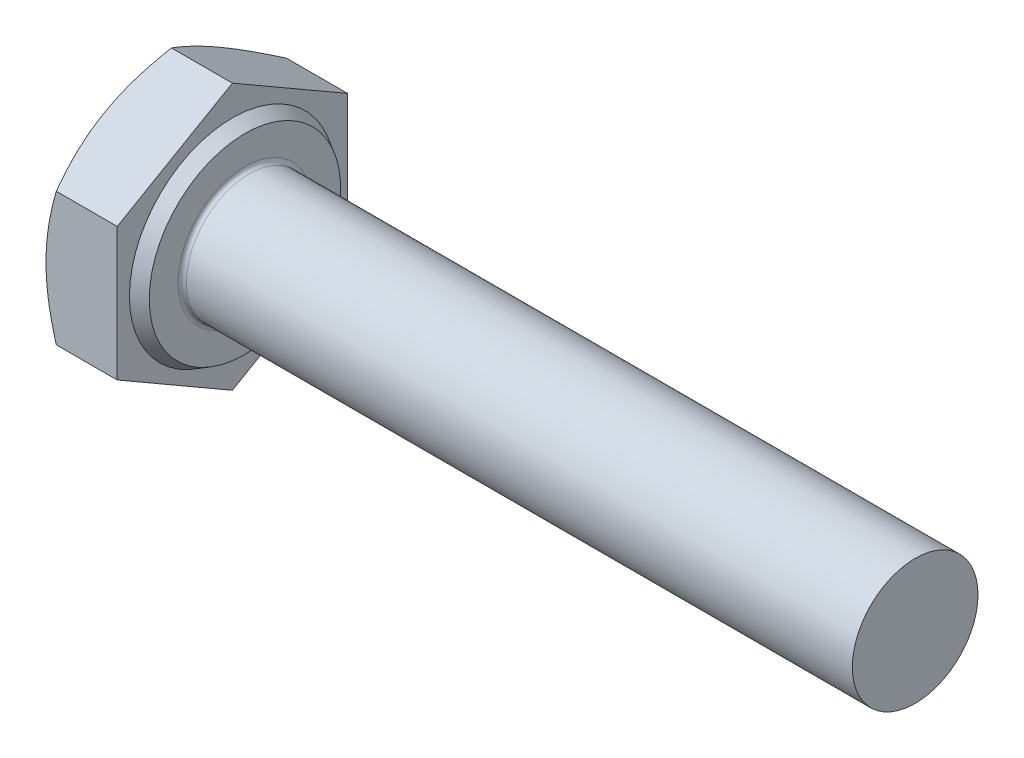
from build123d import *

# Parameters (mm, degrees)
EXTRUDE_400_DEPTH   = 2
FILLET_1302_R       = 0.1
SKETCH_7_R          = 3.348684761
CUT_EXTRUDE_1_DEPTH = 9


with BuildPart() as part:
    # 草图1 → Extrude 400 (new body)
    with BuildSketch(Plane(origin=(0, 0, 0), x_dir=(0, 0, -1), z_dir=(1, 0, 0))):
        Polygon((2.75, 1.58771324), (2.75, -1.58771324), (0, -3.175426481), (-2.75, -1.58771324), (-2.75, 1.58771324), (0, 3.175426481), align=None)
    extrude(amount=EXTRUDE_400_DEPTH)

    # 草图2 → 凸台-旋转1 (revolve)
    with BuildSketch(Plane.XY, mode=Mode.PRIVATE) as revolve_1_sk:
        Polygon((0, 0), (27, 0), (27, 1.067), (27, 1.5), (0, 1.5), align=None)
    revolve(revolve_1_sk.sketch.rotate(Axis((0, 0, 0), (1, 0, 0)), 90), axis=Axis((0, 0, 0), (1, 0, 0)))

    # 草图3 → 切除-旋转1 (revolve, cut)
    with BuildSketch(Plane.XY):
        Polygon((0, 2.75), (3.132371439, 8.175426481), (3.132371439, 13.175426481), (-10, 13.175426481), (-10, 2.75), align=None)
    revolve(axis=Axis((0, 0, 0), (1, 0, 0)), mode=Mode.SUBTRACT)

    # 草图4 → 切除-旋转3 (revolve, cut)
    with BuildSketch(Plane.XY, mode=Mode.PRIVATE) as cut_revolve_3_sk:
        Polygon((2, 2.285), (1.7, 2.458205081), (1.7, 3.175426481), (2, 3.175426481), align=None)
    revolve(cut_revolve_3_sk.sketch.rotate(Axis((0, 0, 0), (1, 0, 0)), 90), axis=Axis((0, 0, 0), (1, 0, 0)), mode=Mode.SUBTRACT)

    # Fillet 1302
    fillet_1302_edges = [part.edges().sort_by_distance(p)[0] for p in [
        (2, 0, -1.5),
    ]]
    fillet(fillet_1302_edges, radius=FILLET_1302_R)

    # 草图6 → 切除-旋转4 (revolve, cut)
    with BuildSketch(Plane.XY, mode=Mode.PRIVATE) as cut_revolve_4_sk:
        Polygon((26.75, 1.5), (27.25, 1.5), (27, 1.066987298), align=None)
    revolve(cut_revolve_4_sk.sketch.rotate(Axis((0, 0, 0), (1, 0, 0)), 90), axis=Axis((0, 0, 0), (1, 0, 0)), mode=Mode.SUBTRACT)

    # 草图7 → 切除-拉伸1 (cut)
    with BuildSketch(Plane(origin=(27, 0, 0), x_dir=(0, 0, -1), z_dir=(1, 0, 0))):
        Circle(SKETCH_7_R)
    extrude(amount=-CUT_EXTRUDE_1_DEPTH, mode=Mode.SUBTRACT)


solid = part.part
